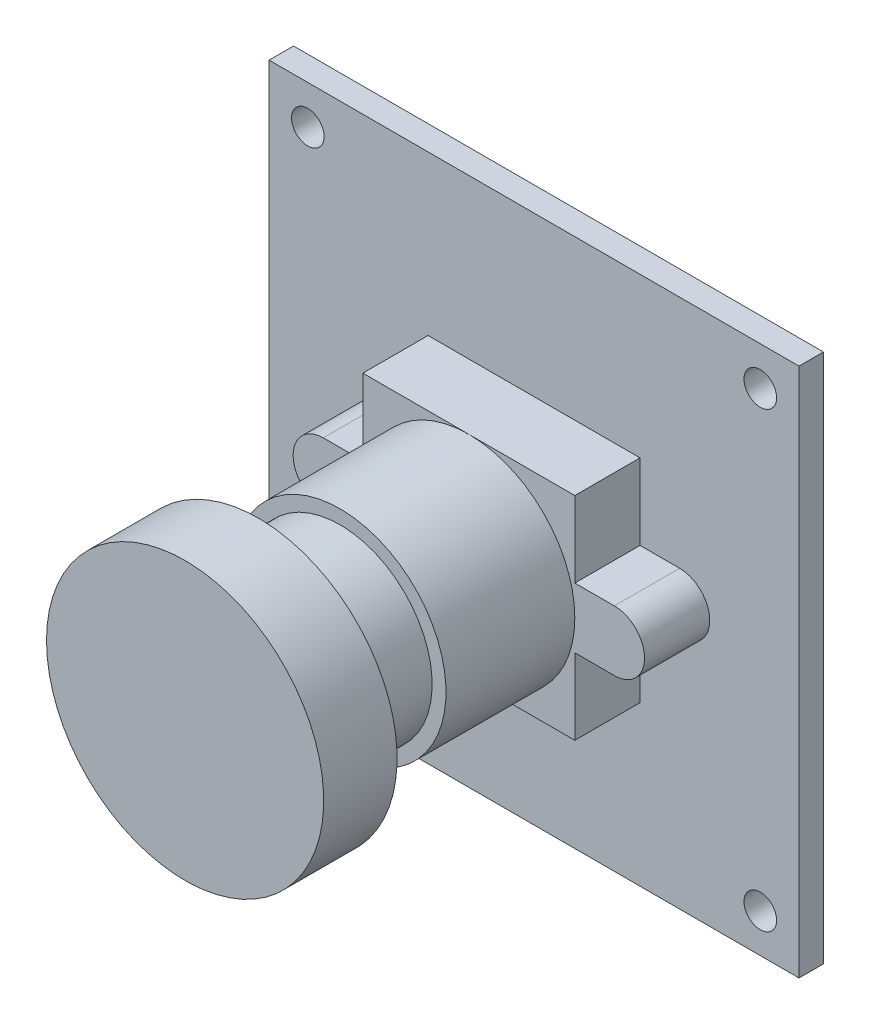
from build123d import *

# Parameters (mm, degrees)
SKETCH2_W           = 32.5
SKETCH2_H           = 32.5
SKETCH2_R           = 1
BOSS_EXTRUDE1_DEPTH = 1.5
SKETCH4_W           = 13
SKETCH4_H           = 13
BOSS_EXTRUDE2_DEPTH = 4
SKETCH6_W           = 10
SKETCH6_H           = 4.75
BOSS_EXTRUDE3_DEPTH = 6


with BuildPart() as part:
    # Sketch2 → Boss-Extrude1 (new body)
    with BuildSketch(Plane.XY):
        Rectangle(SKETCH2_W, SKETCH2_H)
        with Locations((13.875, 13.875)):
            Circle(SKETCH2_R, mode=Mode.SUBTRACT)
        with Locations((13.875, -13.875)):
            Circle(SKETCH2_R, mode=Mode.SUBTRACT)
        with Locations((-13.875, -13.875)):
            Circle(SKETCH2_R, mode=Mode.SUBTRACT)
        with Locations((-13.875, 13.875)):
            Circle(SKETCH2_R, mode=Mode.SUBTRACT)
    extrude(amount=BOSS_EXTRUDE1_DEPTH)

    # Sketch4 → Boss-Extrude2 (add)
    with BuildSketch(Plane.XY.offset(1.5)):
        Rectangle(SKETCH4_W, SKETCH4_H)
        with BuildLine():
            Line((8.925, -1.85), (-8.925, -1.85))
            ThreePointArc((-8.925, -1.85), (-10.775, 0), (-8.925, 1.85))
            Line((-8.925, 1.85), (8.925, 1.85))
            ThreePointArc((8.925, 1.85), (10.775, 0), (8.925, -1.85))
        make_face()
    extrude(amount=BOSS_EXTRUDE2_DEPTH)

    # Sketch5 → Revolve1 (revolve)
    with BuildSketch(Plane(origin=(0, 0, 0), x_dir=(1, 0, 0), z_dir=(0, 1, 0)), mode=Mode.PRIVATE) as revolve1_sk:
        Polygon((0, -5.5), (6.5, -5.5), (6.5, -13.4), (5.65, -13.4), (5.65, -18.4), (8.5, -18.4), (8.5, -22.9), (0, -22.9), align=None)
    revolve(revolve1_sk.sketch.rotate(Axis((0, 0, 0), (0, 0, 1)), 180), axis=Axis((0, 0, 0), (0, 0, 1)))

    # Sketch6 → Boss-Extrude3 (add)
    with BuildSketch(Plane(origin=(0, 0, 0), x_dir=(-1, 0, 0), z_dir=(0, 0, -1))):
        with Locations((0, -13.875)):
            Rectangle(SKETCH6_W, SKETCH6_H)
    extrude(amount=BOSS_EXTRUDE3_DEPTH)


solid = part.part
